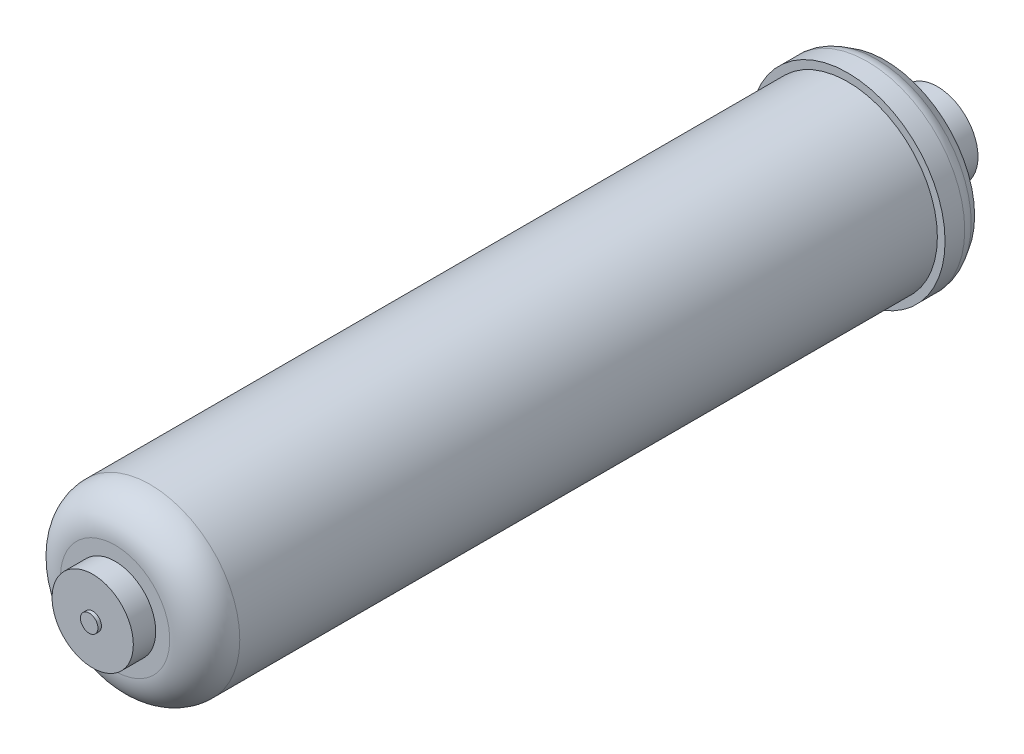
from build123d import *

# Parameters (mm, degrees)
FILLET1_R = 12.7
FILLET2_R = 6.35


with BuildPart() as part:
    # Sketch1 → Revolve1 (revolve)
    with BuildSketch(Plane(origin=(0, 0, 0), x_dir=(0, 0, -1), z_dir=(1, 0, 0)), mode=Mode.PRIVATE) as revolve1_sk:
        Polygon((0, 0), (0, 3.175), (1.27, 3.175), (1.27, 14.732), (9.398, 14.732), (9.398, 32.512), (275.082, 32.512), (275.082, 35.306), (283.972, 35.306), (288.544, 32.555084127), (299.466, 14.732), (307.594, 14.732), (307.594, 3.175), (308.864, 3.175), (308.864, 0), align=None)
    revolve(revolve1_sk.sketch.rotate(Axis((0, 0, 0), (0, 0, -1)), 90), axis=Axis((0, 0, 0), (0, 0, -1)))

    # Fillet1
    fillet1_edges = [part.edges().sort_by_distance(p)[0] for p in [
        (-32.512, 0, -9.398),
    ]]
    fillet(fillet1_edges, radius=FILLET1_R)

    # Fillet2
    fillet2_edges = [part.edges().sort_by_distance(p)[0] for p in [
        (-35.306, 0, -283.972),
    ]]
    fillet(fillet2_edges, radius=FILLET2_R)


solid = part.part
